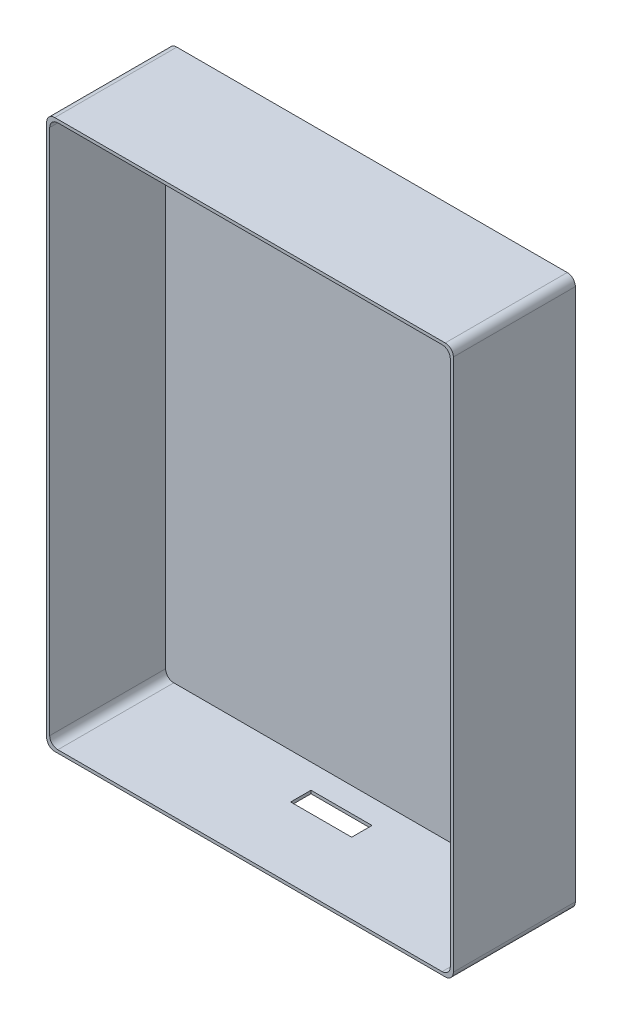
from build123d import *

# Parameters (mm, degrees)
SKETCH1_W           = 100
SKETCH1_H           = 135
BOSS_EXTRUDE1_DEPTH = 30
SKETCH2_W           = 98.5
SKETCH2_H           = 133.5
CUT_EXTRUDE1_DEPTH  = 28.5
FILLET21_R          = 2
FILLET22_R          = 2
CUT_EXTRUDE2_DEPTH  = 1.5


with BuildPart() as part:
    # Sketch1 → Boss-Extrude1 (new body)
    with BuildSketch(Plane.XY):
        Rectangle(SKETCH1_W, SKETCH1_H)
    extrude(amount=BOSS_EXTRUDE1_DEPTH)

    # Sketch2 → Cut-Extrude1 (cut)
    with BuildSketch(Plane.XY.offset(30)):
        Rectangle(SKETCH2_W, SKETCH2_H)
    extrude(amount=-CUT_EXTRUDE1_DEPTH, mode=Mode.SUBTRACT)

    # Fillet21
    fillet21_edges = [part.edges().sort_by_distance(p)[0] for p in [
        (50, -67.5, 15),
        (-50, -67.5, 15),
        (-50, 67.5, 15),
        (50, 67.5, 15),
    ]]
    fillet(fillet21_edges, radius=FILLET21_R)

    # Fillet22
    fillet22_edges = [part.edges().sort_by_distance(p)[0] for p in [
        (49.25, 66.75, 15.75),
        (49.25, -66.75, 15.75),
        (-49.25, -66.75, 15.75),
        (-49.25, 66.75, 15.75),
    ]]
    fillet(fillet22_edges, radius=FILLET22_R)

    # Sketch4 → Cut-Extrude2 (cut)
    with BuildSketch(Plane.XZ.offset(67.5)):
        Polygon((0, 10), (0, 7.5), (7.5, 7.5), (7.5, 12.5), (0, 12.5), align=None)
        Polygon((-7.5, 7.5), (0, 7.5), (0, 10), (0, 12.5), (-7.5, 12.5), align=None)
    extrude(amount=-CUT_EXTRUDE2_DEPTH, mode=Mode.SUBTRACT)


solid = part.part
